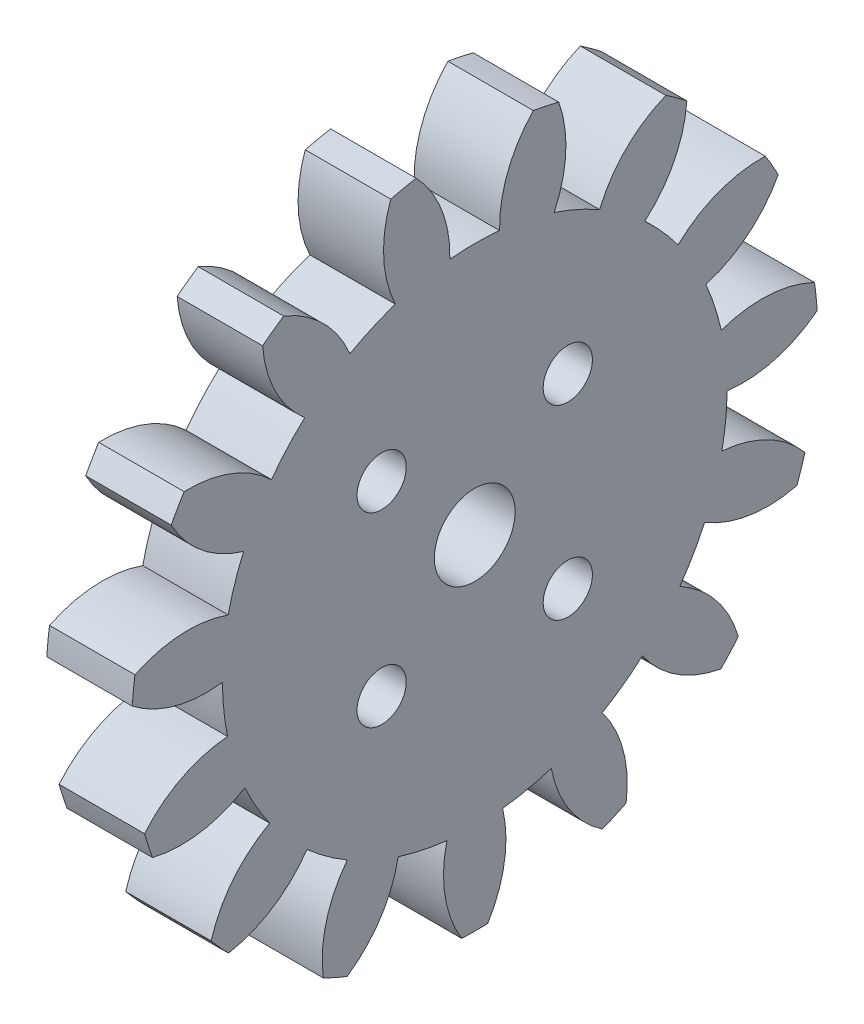
from build123d import *

# Parameters (mm, degrees)
BASPROSKE_W                  = 6.35
BASPROSKE_H                  = 25.5
TOOTHCUT_DEPTH               = 37.617243206
TEETHCUTS_COUNT              = 15
TEETHCUTS_ANGLE              = 336
BORSKE_R                     = 3
BORE_DEPTH                   = 50.0000508
ENL_V_MAT_EXTRU_1_REACH      = 38.578
ESQUISSE1_R                  = 1.83
R_P_TITION_CIRCULAIRE1_COUNT = 4


with BuildPart() as part:
    # BasProSke → Base-Revolve (revolve)
    with BuildSketch(Plane(origin=(0, 0, 0), x_dir=(1, 0, 0), z_dir=(0, 1, 0)), mode=Mode.PRIVATE) as base_revolve_sk:
        with Locations((3.175, 12.75)):
            Rectangle(BASPROSKE_W, BASPROSKE_H)
    revolve(base_revolve_sk.sketch.rotate(Axis((-10, 0, 0), (1, 0, 0)), 180), axis=Axis((-10, 0, 0), (1, 0, 0)))

    # TooCutSke → ToothCut (cut, through all)
    with BuildSketch(Plane(origin=(0, 0, 0), x_dir=(0, 0, -1), z_dir=(1, 0, 0))):
        with BuildLine():
            ThreePointArc((1.848385047, 18.65766528), (0, 18.749), (-1.848385047, 18.65766528))
            ThreePointArc((-1.848385047, 18.65766528), (-2.458619206, 22.156974334), (-4.375272216, 25.147624902))
            ThreePointArc((-4.375272216, 25.147624902), (0, 25.5254), (4.375272216, 25.147624902))
            ThreePointArc((4.375272216, 25.147624902), (2.458619206, 22.156974334), (1.848385047, 18.65766528))
        make_face()
    toothcut = extrude(amount=TOOTHCUT_DEPTH, mode=Mode.SUBTRACT)

    # TeethCuts: ToothCut ×15 about axis
    teethcuts_axis = Axis((-10, 0, 0), (1, 0, 0))
    for i in range(1, TEETHCUTS_COUNT):
        add(toothcut.rotate(teethcuts_axis, i * TEETHCUTS_ANGLE / (TEETHCUTS_COUNT - 1)), mode=Mode.SUBTRACT)

    # BorSke → Bore (cut, symmetric)
    with BuildSketch(Plane(origin=(0, 0, 0), x_dir=(0, 0, -1), z_dir=(1, 0, 0))):
        with Locations(Location((0, 0, 0), (0, 0, 180))):
            Circle(BORSKE_R)
    extrude(amount=BORE_DEPTH, both=True, mode=Mode.SUBTRACT)

    # Esquisse1 → Enlèv. mat.-Extru.1 (cut, up to next)
    with BuildSketch(Plane.ZY, mode=Mode.PRIVATE) as enl_v_mat_extru_1_sk1:
        with Locations((-6.914797213, 6.914797213)):
            Circle(ESQUISSE1_R)
    enl_v_mat_extru_1_tool1 = extrude(enl_v_mat_extru_1_sk1.sketch, amount=-ENL_V_MAT_EXTRU_1_REACH, mode=Mode.PRIVATE) & part.part
    enl_v_mat_extru_1 = enl_v_mat_extru_1_tool1.solids().sort_by_distance((0, 6.914797, -6.914797))[0]
    add(enl_v_mat_extru_1, mode=Mode.SUBTRACT)

    # Répétition circulaire1: Enlèv. mat.-Extru.1 ×4 about axis
    r_p_tition_circulaire1_axis = Axis((0, 0, 0), (1, 0, 0))
    for i in range(1, R_P_TITION_CIRCULAIRE1_COUNT):
        add(enl_v_mat_extru_1.rotate(r_p_tition_circulaire1_axis, i * 360 / R_P_TITION_CIRCULAIRE1_COUNT), mode=Mode.SUBTRACT)


solid = part.part
